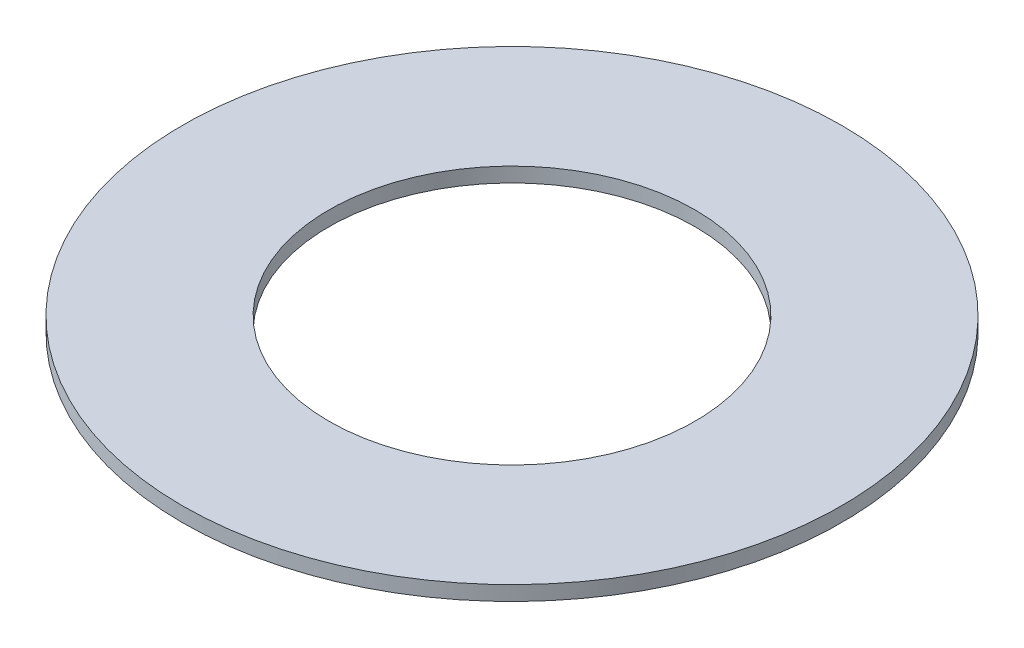
from build123d import *

# Parameters (mm, degrees)
SKIZZE1_R                       = 45
SKIZZE1_R_2                     = 25
AUFSATZ_LINEAR_AUSTRAGEN1_DEPTH = 2


with BuildPart() as part:
    # Skizze1 → Aufsatz-Linear austragen1 (new body)
    with BuildSketch(Plane(origin=(0, 0, 0), x_dir=(1, 0, 0), z_dir=(0, 1, 0))):
        with Locations(Location((0, 0, 0), (0, 0, 270))):
            Circle(SKIZZE1_R)
        with Locations(Location((0, 0, 0), (0, 0, 270))):
            Circle(SKIZZE1_R_2, mode=Mode.SUBTRACT)
    extrude(amount=AUFSATZ_LINEAR_AUSTRAGEN1_DEPTH)


solid = part.part
